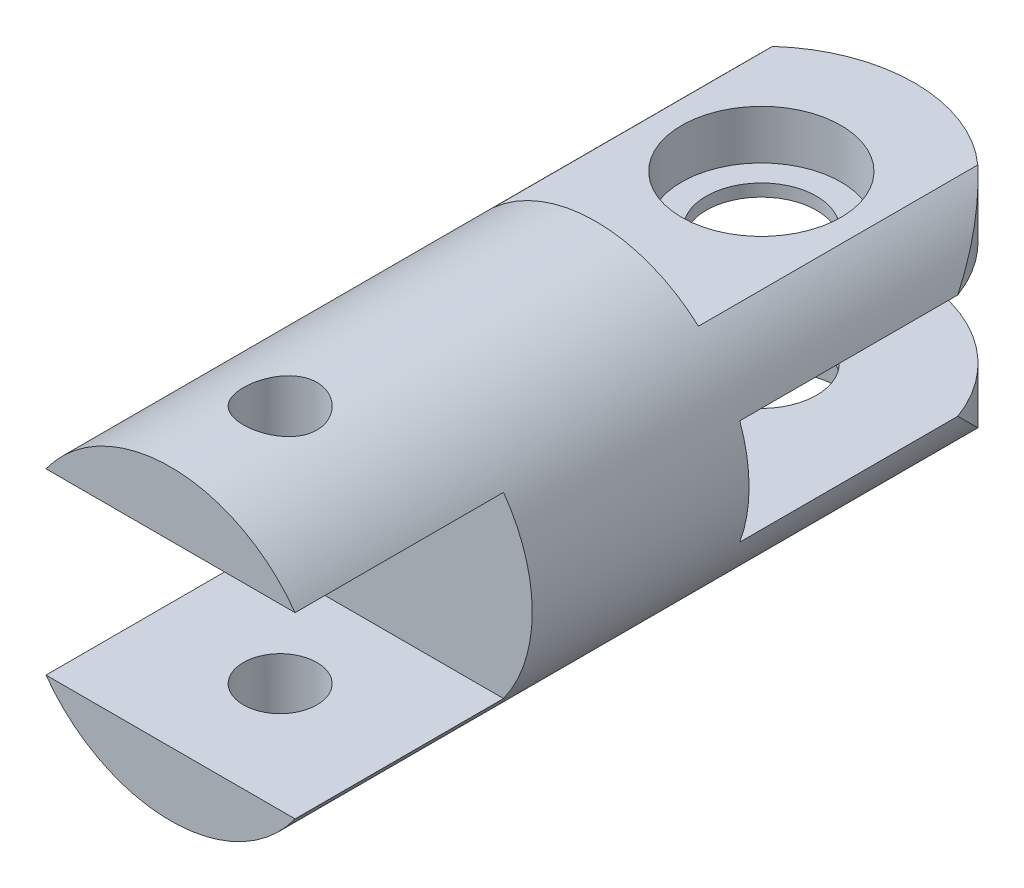
from build123d import *

# Parameters (mm, degrees)
SKETCH_1_R               = 12.5
EXTRUDE_1_DEPTH          = 60.686921397
CUT_EXTRUDE_START        = -26
CUT_EXTRUDE_1_DEPTH      = 26
SKETCH_3_R               = 4.5
CUT_EXTRUDE_2_DEPTH      = 34.123937734
SKETCH_6_R               = 6.5
CUT_EXTRUDE_5_DEPTH      = 4
CUT_EXTRUDE_6_DEPTH      = 17
CUT_EXTRUDE_7_DEPTH      = 29
CUT_EXTRUDE_7_DEPTH_BACK = 17
SKETCH_9_R               = 3


with BuildPart() as part:
    # 스케치1 → 보스-돌출1 (new body)
    with BuildSketch(Plane.XY):
        Circle(SKETCH_1_R)
    extrude(amount=-EXTRUDE_1_DEPTH)

    # 스케치2 → 컷-돌출1 (cut)
    with BuildSketch(Plane(origin=(0, 0, -60.686921397), x_dir=(-1, 0, 0), z_dir=(0, 0, -1)).offset(CUT_EXTRUDE_START)):
        with BuildLine():
            Line((8.371418841, 9.282744561), (-8.371418841, 9.282744561))
            ThreePointArc((-8.371418841, 9.282744561), (0, 12.5), (8.371418841, 9.282744561))
        make_face()
        with BuildLine():
            Line((11.743427908, 4.282744561), (-11.743427908, 4.282744561))
            ThreePointArc((-11.743427908, 4.282744561), (-12.5, 0), (-11.743427908, -4.282744561))
            Line((-11.743427908, -4.282744561), (11.743427908, -4.282744561))
            ThreePointArc((11.743427908, -4.282744561), (12.5, 0), (11.743427908, 4.282744561))
        make_face()
        with BuildLine():
            Line((8.371418841, -9.282744561), (-8.371418841, -9.282744561))
            ThreePointArc((-8.371418841, -9.282744561), (0, -12.5), (8.371418841, -9.282744561))
        make_face()
    extrude(amount=CUT_EXTRUDE_1_DEPTH, mode=Mode.SUBTRACT)

    # 스케치3 → 컷-돌출2 (cut)
    with BuildSketch(Plane(origin=(0, 9.282744561, 0), x_dir=(1, 0, 0), z_dir=(0, 1, 0))):
        with Locations(Location((0, 48.186921397, 0), (0, 0, 270))):
            Circle(SKETCH_3_R)
        with BuildLine():
            Line((-22.5, 48.186921397), (-12.5, 48.186921397))
            ThreePointArc((-12.5, 48.186921397), (0, 60.686921397), (12.5, 48.186921397))
            Line((12.5, 48.186921397), (22.5, 48.186921397))
            ThreePointArc((22.5, 48.186921397), (0, 70.686921397), (-22.5, 48.186921397))
        make_face()
    extrude(amount=-CUT_EXTRUDE_2_DEPTH, mode=Mode.SUBTRACT)

    # 스케치6 → 컷-돌출5 (cut)
    with BuildSketch(Plane(origin=(0, 9.282744561, 0), x_dir=(1, 0, 0), z_dir=(0, 1, 0))):
        with Locations(Location((0, 48.186921397, 0), (0, 0, 270))):
            Circle(SKETCH_6_R)
    cut_extrude_5 = extrude(amount=-CUT_EXTRUDE_5_DEPTH, mode=Mode.SUBTRACT)

    # 대칭 복사3: 컷-돌출5 across plane
    add(cut_extrude_5.mirror(Plane.ZX), mode=Mode.SUBTRACT)

    # 스케치8 → 컷-돌출6 (cut)
    with BuildSketch(Plane.XY):
        with BuildLine():
            Line((10.159210883, 7.282886395), (-10.159210883, 7.282886395))
            ThreePointArc((-10.159210883, 7.282886395), (-12.5, 0), (-10.159210883, -7.282886395))
            Line((-10.159210883, -7.282886395), (10.159210883, -7.282886395))
            ThreePointArc((10.159210883, -7.282886395), (12.5, 0), (10.159210883, 7.282886395))
        make_face()
    extrude(amount=-CUT_EXTRUDE_6_DEPTH, mode=Mode.SUBTRACT)

    # 스케치9 → 컷-돌출7 (cut, two sides: drawn at the far end of the back side and taken through both)
    with BuildSketch(Plane(origin=(0, -7.282886395, 0), x_dir=(1, 0, 0), z_dir=(0, 1, 0)).offset(-CUT_EXTRUDE_7_DEPTH_BACK)):
        with Locations(Location((0, 8.940465454, 0), (0, 0, 90))):
            Circle(SKETCH_9_R)
    extrude(amount=CUT_EXTRUDE_7_DEPTH + CUT_EXTRUDE_7_DEPTH_BACK, mode=Mode.SUBTRACT)


solid = part.part
